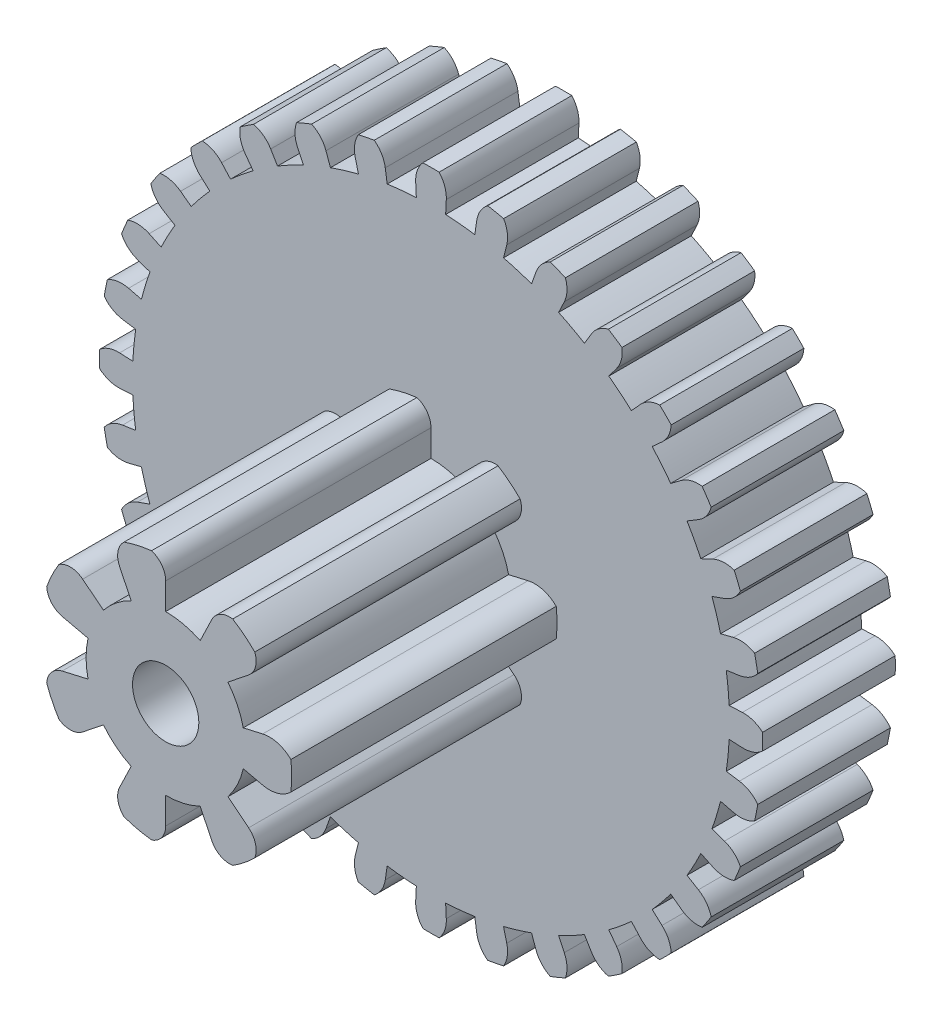
from build123d import *

# Parameters (mm, degrees)
BOSS_EXTRUDE1_DEPTH = 2
BOSS_EXTRUDE2_DEPTH = 4
SKETCH3_R           = 0.5
CUT_EXTRUDE1_DEPTH  = 6


with BuildPart() as part:
    # Sketch1 → Boss-Extrude1 (new body)
    with BuildSketch(Plane.XY):
        with BuildLine():
            Line((4.494579553, 0.220804534), (4.694338644, 0.230618069))
            ThreePointArc((4.694338644, 0.230618069), (4.857073898, 0.206700913), (4.998494093, 0.122706143))
            ThreePointArc((4.998494093, 0.122706143), (5, 0), (4.998494093, -0.122706143))
            ThreePointArc((4.998494093, -0.122706143), (4.857073898, -0.206700913), (4.694338644, -0.230618069))
            Line((4.694338644, -0.230618069), (4.494579553, -0.220804534))
            ThreePointArc((4.494579553, -0.220804534), (4.487807055, -0.331040536), (4.47833127, -0.441077131))
            ThreePointArc((4.47833127, -0.441077131), (4.466157906, -0.550848038), (4.451294295, -0.660287135))
            Line((4.451294295, -0.660287135), (4.649129597, -0.68963323))
            ThreePointArc((4.649129597, -0.68963323), (4.804071932, -0.744838898), (4.926388212, -0.854809444))
            ThreePointArc((4.926388212, -0.854809444), (4.903926402, -0.97545161), (4.87851065, -1.095506201))
            ThreePointArc((4.87851065, -1.095506201), (4.723421237, -1.150297324), (4.55914689, -1.142006846))
            Line((4.55914689, -1.142006846), (4.365140639, -1.09341081))
            ThreePointArc((4.365140639, -1.09341081), (4.336992296, -1.200207409), (4.306231511, -1.306281048))
            ThreePointArc((4.306231511, -1.306281048), (4.272876813, -1.411567832), (4.236948293, -1.51600434))
            Line((4.236948293, -1.51600434), (4.425257106, -1.583382311))
            ThreePointArc((4.425257106, -1.583382311), (4.566452177, -1.667754968), (4.664963994, -1.799475183))
            ThreePointArc((4.664963994, -1.799475183), (4.619397663, -1.913417162), (4.571048779, -2.02620657))
            ThreePointArc((4.571048779, -2.02620657), (4.408250147, -2.049688453), (4.248749678, -2.009508939))
            Line((4.248749678, -2.009508939), (4.067951819, -1.92399792))
            ThreePointArc((4.067951819, -1.92399792), (4.019509355, -2.023250983), (3.96864569, -2.121285316))
            ThreePointArc((3.96864569, -2.121285316), (3.91539146, -2.218041865), (3.859778745, -2.313462349))
            Line((3.859778745, -2.313462349), (4.031324467, -2.416282898))
            ThreePointArc((4.031324467, -2.416282898), (4.153346225, -2.526580149), (4.224267826, -2.674988099))
            ThreePointArc((4.224267826, -2.674988099), (4.157348062, -2.777851165), (4.087924066, -2.879040957))
            ThreePointArc((4.087924066, -2.879040957), (3.923672476, -2.870311205), (3.775075398, -2.799786731))
            Line((3.775075398, -2.799786731), (3.614433892, -2.68064687))
            ThreePointArc((3.614433892, -2.68064687), (3.547558924, -2.768542158), (3.47854704, -2.854769779))
            ThreePointArc((3.47854704, -2.854769779), (3.407439809, -2.939277793), (3.334280064, -3.022015297))
            Line((3.334280064, -3.022015297), (3.482470289, -3.156327088))
            ThreePointArc((3.482470289, -3.156327088), (3.580629507, -3.288310273), (3.621235415, -3.447702724))
            ThreePointArc((3.621235415, -3.447702724), (3.535533906, -3.535533906), (3.447702724, -3.621235415))
            ThreePointArc((3.447702724, -3.621235415), (3.288310273, -3.580629507), (3.156327088, -3.482470289))
            Line((3.156327088, -3.482470289), (3.022015297, -3.334280064))
            ThreePointArc((3.022015297, -3.334280064), (2.939277793, -3.407439809), (2.854769779, -3.47854704))
            ThreePointArc((2.854769779, -3.47854704), (2.768542158, -3.547558924), (2.68064687, -3.614433892))
            Line((2.68064687, -3.614433892), (2.799786731, -3.775075398))
            ThreePointArc((2.799786731, -3.775075398), (2.870311205, -3.923672476), (2.879040957, -4.087924066))
            ThreePointArc((2.879040957, -4.087924066), (2.777851165, -4.157348062), (2.674988099, -4.224267826))
            ThreePointArc((2.674988099, -4.224267826), (2.526580149, -4.153346225), (2.416282898, -4.031324467))
            Line((2.416282898, -4.031324467), (2.313462349, -3.859778745))
            ThreePointArc((2.313462349, -3.859778745), (2.218041865, -3.91539146), (2.121285316, -3.96864569))
            ThreePointArc((2.121285316, -3.96864569), (2.023250983, -4.019509355), (1.92399792, -4.067951819))
            Line((1.92399792, -4.067951819), (2.009508939, -4.248749678))
            ThreePointArc((2.009508939, -4.248749678), (2.049688453, -4.408250147), (2.02620657, -4.571048779))
            ThreePointArc((2.02620657, -4.571048779), (1.913417162, -4.619397663), (1.799475183, -4.664963994))
            ThreePointArc((1.799475183, -4.664963994), (1.667754968, -4.566452177), (1.583382311, -4.425257106))
            Line((1.583382311, -4.425257106), (1.51600434, -4.236948293))
            ThreePointArc((1.51600434, -4.236948293), (1.411567832, -4.272876813), (1.306281048, -4.306231511))
            ThreePointArc((1.306281048, -4.306231511), (1.200207409, -4.336992296), (1.09341081, -4.365140639))
            Line((1.09341081, -4.365140639), (1.142006846, -4.55914689))
            ThreePointArc((1.142006846, -4.55914689), (1.150297324, -4.723421237), (1.095506201, -4.87851065))
            ThreePointArc((1.095506201, -4.87851065), (0.97545161, -4.903926402), (0.854809444, -4.926388212))
            ThreePointArc((0.854809444, -4.926388212), (0.744838898, -4.804071932), (0.68963323, -4.649129597))
            Line((0.68963323, -4.649129597), (0.660287135, -4.451294295))
            ThreePointArc((0.660287135, -4.451294295), (0.550848038, -4.466157906), (0.441077131, -4.47833127))
            ThreePointArc((0.441077131, -4.47833127), (0.331040536, -4.487807055), (0.220804534, -4.494579553))
            Line((0.220804534, -4.494579553), (0.230618069, -4.694338644))
            ThreePointArc((0.230618069, -4.694338644), (0.206700913, -4.857073898), (0.122706143, -4.998494093))
            ThreePointArc((0.122706143, -4.998494093), (0, -5), (-0.122706143, -4.998494093))
            ThreePointArc((-0.122706143, -4.998494093), (-0.206700913, -4.857073898), (-0.230618069, -4.694338644))
            Line((-0.230618069, -4.694338644), (-0.220804534, -4.494579553))
            ThreePointArc((-0.220804534, -4.494579553), (-0.331040536, -4.487807055), (-0.441077131, -4.47833127))
            ThreePointArc((-0.441077131, -4.47833127), (-0.550848038, -4.466157906), (-0.660287135, -4.451294295))
            Line((-0.660287135, -4.451294295), (-0.68963323, -4.649129597))
            ThreePointArc((-0.68963323, -4.649129597), (-0.744838898, -4.804071932), (-0.854809444, -4.926388212))
            ThreePointArc((-0.854809444, -4.926388212), (-0.97545161, -4.903926402), (-1.095506201, -4.87851065))
            ThreePointArc((-1.095506201, -4.87851065), (-1.150297324, -4.723421237), (-1.142006846, -4.55914689))
            Line((-1.142006846, -4.55914689), (-1.09341081, -4.365140639))
            ThreePointArc((-1.09341081, -4.365140639), (-1.200207409, -4.336992296), (-1.306281048, -4.306231511))
            ThreePointArc((-1.306281048, -4.306231511), (-1.411567832, -4.272876813), (-1.51600434, -4.236948293))
            Line((-1.51600434, -4.236948293), (-1.583382311, -4.425257106))
            ThreePointArc((-1.583382311, -4.425257106), (-1.667754968, -4.566452177), (-1.799475183, -4.664963994))
            ThreePointArc((-1.799475183, -4.664963994), (-1.913417162, -4.619397663), (-2.02620657, -4.571048779))
            ThreePointArc((-2.02620657, -4.571048779), (-2.049688453, -4.408250147), (-2.009508939, -4.248749678))
            Line((-2.009508939, -4.248749678), (-1.92399792, -4.067951819))
            ThreePointArc((-1.92399792, -4.067951819), (-2.023250983, -4.019509355), (-2.121285316, -3.96864569))
            ThreePointArc((-2.121285316, -3.96864569), (-2.218041865, -3.91539146), (-2.313462349, -3.859778745))
            Line((-2.313462349, -3.859778745), (-2.416282898, -4.031324467))
            ThreePointArc((-2.416282898, -4.031324467), (-2.526580149, -4.153346225), (-2.674988099, -4.224267826))
            ThreePointArc((-2.674988099, -4.224267826), (-2.777851165, -4.157348062), (-2.879040957, -4.087924066))
            ThreePointArc((-2.879040957, -4.087924066), (-2.870311205, -3.923672476), (-2.799786731, -3.775075398))
            Line((-2.799786731, -3.775075398), (-2.68064687, -3.614433892))
            ThreePointArc((-2.68064687, -3.614433892), (-2.768542158, -3.547558924), (-2.854769779, -3.47854704))
            ThreePointArc((-2.854769779, -3.47854704), (-2.939277793, -3.407439809), (-3.022015297, -3.334280064))
            Line((-3.022015297, -3.334280064), (-3.156327088, -3.482470289))
            ThreePointArc((-3.156327088, -3.482470289), (-3.288310273, -3.580629507), (-3.447702724, -3.621235415))
            ThreePointArc((-3.447702724, -3.621235415), (-3.535533906, -3.535533906), (-3.621235415, -3.447702724))
            ThreePointArc((-3.621235415, -3.447702724), (-3.580629507, -3.288310273), (-3.482470289, -3.156327088))
            Line((-3.482470289, -3.156327088), (-3.334280064, -3.022015297))
            ThreePointArc((-3.334280064, -3.022015297), (-3.407439809, -2.939277793), (-3.47854704, -2.854769779))
            ThreePointArc((-3.47854704, -2.854769779), (-3.547558924, -2.768542158), (-3.614433892, -2.68064687))
            Line((-3.614433892, -2.68064687), (-3.775075398, -2.799786731))
            ThreePointArc((-3.775075398, -2.799786731), (-3.923672476, -2.870311205), (-4.087924066, -2.879040957))
            ThreePointArc((-4.087924066, -2.879040957), (-4.157348062, -2.777851165), (-4.224267826, -2.674988099))
            ThreePointArc((-4.224267826, -2.674988099), (-4.153346225, -2.526580149), (-4.031324467, -2.416282898))
            Line((-4.031324467, -2.416282898), (-3.859778745, -2.313462349))
            ThreePointArc((-3.859778745, -2.313462349), (-3.91539146, -2.218041865), (-3.96864569, -2.121285316))
            ThreePointArc((-3.96864569, -2.121285316), (-4.019509355, -2.023250983), (-4.067951819, -1.92399792))
            Line((-4.067951819, -1.92399792), (-4.248749678, -2.009508939))
            ThreePointArc((-4.248749678, -2.009508939), (-4.408250147, -2.049688453), (-4.571048779, -2.02620657))
            ThreePointArc((-4.571048779, -2.02620657), (-4.619397663, -1.913417162), (-4.664963994, -1.799475183))
            ThreePointArc((-4.664963994, -1.799475183), (-4.566452177, -1.667754968), (-4.425257106, -1.583382311))
            Line((-4.425257106, -1.583382311), (-4.236948293, -1.51600434))
            ThreePointArc((-4.236948293, -1.51600434), (-4.272876813, -1.411567832), (-4.306231511, -1.306281048))
            ThreePointArc((-4.306231511, -1.306281048), (-4.336992296, -1.200207409), (-4.365140639, -1.09341081))
            Line((-4.365140639, -1.09341081), (-4.55914689, -1.142006846))
            ThreePointArc((-4.55914689, -1.142006846), (-4.723421237, -1.150297324), (-4.87851065, -1.095506201))
            ThreePointArc((-4.87851065, -1.095506201), (-4.903926402, -0.97545161), (-4.926388212, -0.854809444))
            ThreePointArc((-4.926388212, -0.854809444), (-4.804071932, -0.744838898), (-4.649129597, -0.68963323))
            Line((-4.649129597, -0.68963323), (-4.451294295, -0.660287135))
            ThreePointArc((-4.451294295, -0.660287135), (-4.466157906, -0.550848038), (-4.47833127, -0.441077131))
            ThreePointArc((-4.47833127, -0.441077131), (-4.487807055, -0.331040536), (-4.494579553, -0.220804534))
            Line((-4.494579553, -0.220804534), (-4.694338644, -0.230618069))
            ThreePointArc((-4.694338644, -0.230618069), (-4.857073898, -0.206700913), (-4.998494093, -0.122706143))
            ThreePointArc((-4.998494093, -0.122706143), (-5, 0), (-4.998494093, 0.122706143))
            ThreePointArc((-4.998494093, 0.122706143), (-4.857073898, 0.206700913), (-4.694338644, 0.230618069))
            Line((-4.694338644, 0.230618069), (-4.494579553, 0.220804534))
            ThreePointArc((-4.494579553, 0.220804534), (-4.487807055, 0.331040536), (-4.47833127, 0.441077131))
            ThreePointArc((-4.47833127, 0.441077131), (-4.466157906, 0.550848038), (-4.451294295, 0.660287135))
            Line((-4.451294295, 0.660287135), (-4.649129597, 0.68963323))
            ThreePointArc((-4.649129597, 0.68963323), (-4.804071932, 0.744838898), (-4.926388212, 0.854809444))
            ThreePointArc((-4.926388212, 0.854809444), (-4.903926402, 0.97545161), (-4.87851065, 1.095506201))
            ThreePointArc((-4.87851065, 1.095506201), (-4.723421237, 1.150297324), (-4.55914689, 1.142006846))
            Line((-4.55914689, 1.142006846), (-4.365140639, 1.09341081))
            ThreePointArc((-4.365140639, 1.09341081), (-4.336992296, 1.200207409), (-4.306231511, 1.306281048))
            ThreePointArc((-4.306231511, 1.306281048), (-4.272876813, 1.411567832), (-4.236948293, 1.51600434))
            Line((-4.236948293, 1.51600434), (-4.425257106, 1.583382311))
            ThreePointArc((-4.425257106, 1.583382311), (-4.566452177, 1.667754968), (-4.664963994, 1.799475183))
            ThreePointArc((-4.664963994, 1.799475183), (-4.619397663, 1.913417162), (-4.571048779, 2.02620657))
            ThreePointArc((-4.571048779, 2.02620657), (-4.408250147, 2.049688453), (-4.248749678, 2.009508939))
            Line((-4.248749678, 2.009508939), (-4.067951819, 1.92399792))
            ThreePointArc((-4.067951819, 1.92399792), (-4.019509355, 2.023250983), (-3.96864569, 2.121285316))
            ThreePointArc((-3.96864569, 2.121285316), (-3.91539146, 2.218041865), (-3.859778745, 2.313462349))
            Line((-3.859778745, 2.313462349), (-4.031324467, 2.416282898))
            ThreePointArc((-4.031324467, 2.416282898), (-4.153346225, 2.526580149), (-4.224267826, 2.674988099))
            ThreePointArc((-4.224267826, 2.674988099), (-4.157348062, 2.777851165), (-4.087924066, 2.879040957))
            ThreePointArc((-4.087924066, 2.879040957), (-3.923672476, 2.870311205), (-3.775075398, 2.799786731))
            Line((-3.775075398, 2.799786731), (-3.614433892, 2.68064687))
            ThreePointArc((-3.614433892, 2.68064687), (-3.547558924, 2.768542158), (-3.47854704, 2.854769779))
            ThreePointArc((-3.47854704, 2.854769779), (-3.407439809, 2.939277793), (-3.334280064, 3.022015297))
            Line((-3.334280064, 3.022015297), (-3.482470289, 3.156327088))
            ThreePointArc((-3.482470289, 3.156327088), (-3.580629507, 3.288310273), (-3.621235415, 3.447702724))
            ThreePointArc((-3.621235415, 3.447702724), (-3.535533906, 3.535533906), (-3.447702724, 3.621235415))
            ThreePointArc((-3.447702724, 3.621235415), (-3.288310273, 3.580629507), (-3.156327088, 3.482470289))
            Line((-3.156327088, 3.482470289), (-3.022015297, 3.334280064))
            ThreePointArc((-3.022015297, 3.334280064), (-2.939277793, 3.407439809), (-2.854769779, 3.47854704))
            ThreePointArc((-2.854769779, 3.47854704), (-2.768542158, 3.547558924), (-2.68064687, 3.614433892))
            Line((-2.68064687, 3.614433892), (-2.799786731, 3.775075398))
            ThreePointArc((-2.799786731, 3.775075398), (-2.870311205, 3.923672476), (-2.879040957, 4.087924066))
            ThreePointArc((-2.879040957, 4.087924066), (-2.777851165, 4.157348062), (-2.674988099, 4.224267826))
            ThreePointArc((-2.674988099, 4.224267826), (-2.526580149, 4.153346225), (-2.416282898, 4.031324467))
            Line((-2.416282898, 4.031324467), (-2.313462349, 3.859778745))
            ThreePointArc((-2.313462349, 3.859778745), (-2.218041865, 3.91539146), (-2.121285316, 3.96864569))
            ThreePointArc((-2.121285316, 3.96864569), (-2.023250983, 4.019509355), (-1.92399792, 4.067951819))
            Line((-1.92399792, 4.067951819), (-2.009508939, 4.248749678))
            ThreePointArc((-2.009508939, 4.248749678), (-2.049688453, 4.408250147), (-2.02620657, 4.571048779))
            ThreePointArc((-2.02620657, 4.571048779), (-1.913417162, 4.619397663), (-1.799475183, 4.664963994))
            ThreePointArc((-1.799475183, 4.664963994), (-1.667754968, 4.566452177), (-1.583382311, 4.425257106))
            Line((-1.583382311, 4.425257106), (-1.51600434, 4.236948293))
            ThreePointArc((-1.51600434, 4.236948293), (-1.411567832, 4.272876813), (-1.306281048, 4.306231511))
            ThreePointArc((-1.306281048, 4.306231511), (-1.200207409, 4.336992296), (-1.09341081, 4.365140639))
            Line((-1.09341081, 4.365140639), (-1.142006846, 4.55914689))
            ThreePointArc((-1.142006846, 4.55914689), (-1.150297324, 4.723421237), (-1.095506201, 4.87851065))
            ThreePointArc((-1.095506201, 4.87851065), (-0.97545161, 4.903926402), (-0.854809444, 4.926388212))
            ThreePointArc((-0.854809444, 4.926388212), (-0.744838898, 4.804071932), (-0.68963323, 4.649129597))
            Line((-0.68963323, 4.649129597), (-0.660287135, 4.451294295))
            ThreePointArc((-0.660287135, 4.451294295), (-0.550848038, 4.466157906), (-0.441077131, 4.47833127))
            ThreePointArc((-0.441077131, 4.47833127), (-0.331040536, 4.487807055), (-0.220804534, 4.494579553))
            Line((-0.220804534, 4.494579553), (-0.230618069, 4.694338644))
            ThreePointArc((-0.230618069, 4.694338644), (-0.206700913, 4.857073898), (-0.122706143, 4.998494093))
            ThreePointArc((-0.122706143, 4.998494093), (0, 5), (0.122706143, 4.998494093))
            ThreePointArc((0.122706143, 4.998494093), (0.206700913, 4.857073898), (0.230618069, 4.694338644))
            Line((0.230618069, 4.694338644), (0.220804534, 4.494579553))
            ThreePointArc((0.220804534, 4.494579553), (0.331040536, 4.487807055), (0.441077131, 4.47833127))
            ThreePointArc((0.441077131, 4.47833127), (0.550848038, 4.466157906), (0.660287135, 4.451294295))
            Line((0.660287135, 4.451294295), (0.68963323, 4.649129597))
            ThreePointArc((0.68963323, 4.649129597), (0.744838898, 4.804071932), (0.854809444, 4.926388212))
            ThreePointArc((0.854809444, 4.926388212), (0.97545161, 4.903926402), (1.095506201, 4.87851065))
            ThreePointArc((1.095506201, 4.87851065), (1.150297324, 4.723421237), (1.142006846, 4.55914689))
            Line((1.142006846, 4.55914689), (1.09341081, 4.365140639))
            ThreePointArc((1.09341081, 4.365140639), (1.200207409, 4.336992296), (1.306281048, 4.306231511))
            ThreePointArc((1.306281048, 4.306231511), (1.411567832, 4.272876813), (1.51600434, 4.236948293))
            Line((1.51600434, 4.236948293), (1.583382311, 4.425257106))
            ThreePointArc((1.583382311, 4.425257106), (1.667754968, 4.566452177), (1.799475183, 4.664963994))
            ThreePointArc((1.799475183, 4.664963994), (1.913417162, 4.619397663), (2.02620657, 4.571048779))
            ThreePointArc((2.02620657, 4.571048779), (2.049688453, 4.408250147), (2.009508939, 4.248749678))
            Line((2.009508939, 4.248749678), (1.92399792, 4.067951819))
            ThreePointArc((1.92399792, 4.067951819), (2.023250983, 4.019509355), (2.121285316, 3.96864569))
            ThreePointArc((2.121285316, 3.96864569), (2.218041865, 3.91539146), (2.313462349, 3.859778745))
            Line((2.313462349, 3.859778745), (2.416282898, 4.031324467))
            ThreePointArc((2.416282898, 4.031324467), (2.526580149, 4.153346225), (2.674988099, 4.224267826))
            ThreePointArc((2.674988099, 4.224267826), (2.777851165, 4.157348062), (2.879040957, 4.087924066))
            ThreePointArc((2.879040957, 4.087924066), (2.870311205, 3.923672476), (2.799786731, 3.775075398))
            Line((2.799786731, 3.775075398), (2.68064687, 3.614433892))
            ThreePointArc((2.68064687, 3.614433892), (2.768542158, 3.547558924), (2.854769779, 3.47854704))
            ThreePointArc((2.854769779, 3.47854704), (2.939277793, 3.407439809), (3.022015297, 3.334280064))
            Line((3.022015297, 3.334280064), (3.156327088, 3.482470289))
            ThreePointArc((3.156327088, 3.482470289), (3.288310273, 3.580629507), (3.447702724, 3.621235415))
            ThreePointArc((3.447702724, 3.621235415), (3.535533906, 3.535533906), (3.621235415, 3.447702724))
            ThreePointArc((3.621235415, 3.447702724), (3.580629507, 3.288310273), (3.482470289, 3.156327088))
            Line((3.482470289, 3.156327088), (3.334280064, 3.022015297))
            ThreePointArc((3.334280064, 3.022015297), (3.407439809, 2.939277793), (3.47854704, 2.854769779))
            ThreePointArc((3.47854704, 2.854769779), (3.547558924, 2.768542158), (3.614433892, 2.68064687))
            Line((3.614433892, 2.68064687), (3.775075398, 2.799786731))
            ThreePointArc((3.775075398, 2.799786731), (3.923672476, 2.870311205), (4.087924066, 2.879040957))
            ThreePointArc((4.087924066, 2.879040957), (4.157348062, 2.777851165), (4.224267826, 2.674988099))
            ThreePointArc((4.224267826, 2.674988099), (4.153346225, 2.526580149), (4.031324467, 2.416282898))
            Line((4.031324467, 2.416282898), (3.859778745, 2.313462349))
            ThreePointArc((3.859778745, 2.313462349), (3.91539146, 2.218041865), (3.96864569, 2.121285316))
            ThreePointArc((3.96864569, 2.121285316), (4.019509355, 2.023250983), (4.067951819, 1.92399792))
            Line((4.067951819, 1.92399792), (4.248749678, 2.009508939))
            ThreePointArc((4.248749678, 2.009508939), (4.408250147, 2.049688453), (4.571048779, 2.02620657))
            ThreePointArc((4.571048779, 2.02620657), (4.619397663, 1.913417162), (4.664963994, 1.799475183))
            ThreePointArc((4.664963994, 1.799475183), (4.566452177, 1.667754968), (4.425257106, 1.583382311))
            Line((4.425257106, 1.583382311), (4.236948293, 1.51600434))
            ThreePointArc((4.236948293, 1.51600434), (4.272876813, 1.411567832), (4.306231511, 1.306281048))
            ThreePointArc((4.306231511, 1.306281048), (4.336992296, 1.200207409), (4.365140639, 1.09341081))
            Line((4.365140639, 1.09341081), (4.55914689, 1.142006846))
            ThreePointArc((4.55914689, 1.142006846), (4.723421237, 1.150297324), (4.87851065, 1.095506201))
            ThreePointArc((4.87851065, 1.095506201), (4.903926402, 0.97545161), (4.926388212, 0.854809444))
            ThreePointArc((4.926388212, 0.854809444), (4.804071932, 0.744838898), (4.649129597, 0.68963323))
            Line((4.649129597, 0.68963323), (4.451294295, 0.660287135))
            ThreePointArc((4.451294295, 0.660287135), (4.466157906, 0.550848038), (4.47833127, 0.441077131))
            ThreePointArc((4.47833127, 0.441077131), (4.487807055, 0.331040536), (4.494579553, 0.220804534))
        make_face()
    extrude(amount=BOSS_EXTRUDE1_DEPTH)

    # Sketch2 → Boss-Extrude2 (add)
    with BuildSketch(Plane.XY.offset(2)):
        with BuildLine():
            ThreePointArc((1.081162641, 0.520660487), (1.13266049, 0.396333462), (1.16991416, 0.267022204))
            Line((1.16991416, 0.267022204), (1.4623927, 0.333777755))
            ThreePointArc((1.4623927, 0.333777755), (1.690723794, 0.327764421), (1.888053204, 0.212732458))
            ThreePointArc((1.888053204, 0.212732458), (1.9, 0), (1.888053204, -0.212732458))
            ThreePointArc((1.888053204, -0.212732458), (1.690723794, -0.327764421), (1.4623927, -0.333777755))
            Line((1.4623927, -0.333777755), (1.16991416, -0.267022204))
            ThreePointArc((1.16991416, -0.267022204), (1.13266049, -0.396333462), (1.081162641, -0.520660487))
            ThreePointArc((1.081162641, -0.520660487), (1.016068243, -0.638439759), (0.938195913, -0.748190101))
            Line((0.938195913, -0.748190101), (1.250927885, -0.997586802))
            ThreePointArc((1.250927885, -0.997586802), (1.354157844, -1.155305767), (1.343502851, -1.343502918))
            ThreePointArc((1.343502851, -1.343502918), (1.184630624, -1.485479817), (1.010860985, -1.608775953))
            ThreePointArc((1.010860985, -1.608775953), (0.825011371, -1.577285998), (0.694217577, -1.441548458))
            Line((0.694217577, -1.441548458), (0.520663183, -1.081161343))
            ThreePointArc((0.520663183, -1.081161343), (0.396336286, -1.132659502), (0.267025121, -1.169913495))
            ThreePointArc((0.267025121, -1.169913495), (0.134355885, -1.192454819), (-2.992e-06, -1.2))
            Line((-2.992e-06, -1.2), (-3.989e-06, -1.6))
            ThreePointArc((-3.989e-06, -1.6), (-0.058950815, -1.779044598), (-0.212732552, -1.888053193))
            ThreePointArc((-0.212732552, -1.888053193), (-0.422789775, -1.852363033), (-0.627530173, -1.793378343))
            ThreePointArc((-0.627530173, -1.793378343), (-0.718785674, -1.628441598), (-0.694210388, -1.44155192))
            Line((-0.694210388, -1.44155192), (-0.520657791, -1.08116394))
            ThreePointArc((-0.520657791, -1.08116394), (-0.638437225, -1.016069835), (-0.748187762, -0.938197779))
            ThreePointArc((-0.748187762, -0.938197779), (-0.848529195, -0.84852708), (-0.938199644, -0.748185423))
            Line((-0.938199644, -0.748185423), (-1.250932859, -0.997580564))
            ThreePointArc((-1.250932859, -0.997580564), (-1.427668308, -1.063126561), (-1.608776004, -1.010860905))
            ThreePointArc((-1.608776004, -1.010860905), (-1.711840849, -0.824379104), (-1.793378312, -0.627530262))
            ThreePointArc((-1.793378312, -0.627530262), (-1.721322446, -0.45334746), (-1.559883772, -0.356037384))
            Line((-1.559883772, -0.356037384), (-1.169912829, -0.267028038))
            ThreePointArc((-1.169912829, -0.267028038), (-1.192454484, -0.134358858), (-1.2, 0))
            ThreePointArc((-1.2, 0), (-1.192454484, 0.134358858), (-1.169912829, 0.267028038))
            Line((-1.169912829, 0.267028038), (-1.559883772, 0.356037384))
            ThreePointArc((-1.559883772, 0.356037384), (-1.721322446, 0.45334746), (-1.793378312, 0.627530262))
            ThreePointArc((-1.793378312, 0.627530262), (-1.711840849, 0.824379104), (-1.608776004, 1.010860905))
            ThreePointArc((-1.608776004, 1.010860905), (-1.427668308, 1.063126561), (-1.250932859, 0.997580564))
            Line((-1.250932859, 0.997580564), (-0.938199644, 0.748185423))
            ThreePointArc((-0.938199644, 0.748185423), (-0.848529195, 0.84852708), (-0.748187762, 0.938197779))
            ThreePointArc((-0.748187762, 0.938197779), (-0.638437225, 1.016069835), (-0.520657791, 1.08116394))
            Line((-0.520657791, 1.08116394), (-0.694210388, 1.44155192))
            ThreePointArc((-0.694210388, 1.44155192), (-0.718785674, 1.628441598), (-0.627530173, 1.793378343))
            ThreePointArc((-0.627530173, 1.793378343), (-0.422789775, 1.852363033), (-0.212732552, 1.888053193))
            ThreePointArc((-0.212732552, 1.888053193), (-0.058950815, 1.779044598), (-3.989e-06, 1.6))
            Line((-3.989e-06, 1.6), (-2.992e-06, 1.2))
            ThreePointArc((-2.992e-06, 1.2), (0.134355885, 1.192454819), (0.267025121, 1.169913495))
            ThreePointArc((0.267025121, 1.169913495), (0.396336286, 1.132659502), (0.520663183, 1.081161343))
            Line((0.520663183, 1.081161343), (0.694217577, 1.441548458))
            ThreePointArc((0.694217577, 1.441548458), (0.825011371, 1.577285998), (1.010860985, 1.608775953))
            ThreePointArc((1.010860985, 1.608775953), (1.184630624, 1.485479817), (1.343502851, 1.343502918))
            ThreePointArc((1.343502851, 1.343502918), (1.354157844, 1.155305767), (1.250927885, 0.997586802))
            Line((1.250927885, 0.997586802), (0.938195913, 0.748190101))
            ThreePointArc((0.938195913, 0.748190101), (1.016068243, 0.638439759), (1.081162641, 0.520660487))
        make_face()
    extrude(amount=BOSS_EXTRUDE2_DEPTH)

    # Sketch3 → Cut-Extrude1 (cut)
    with BuildSketch(Plane.XY.offset(6)):
        Circle(SKETCH3_R)
    extrude(amount=-CUT_EXTRUDE1_DEPTH, mode=Mode.SUBTRACT)


solid = part.part
